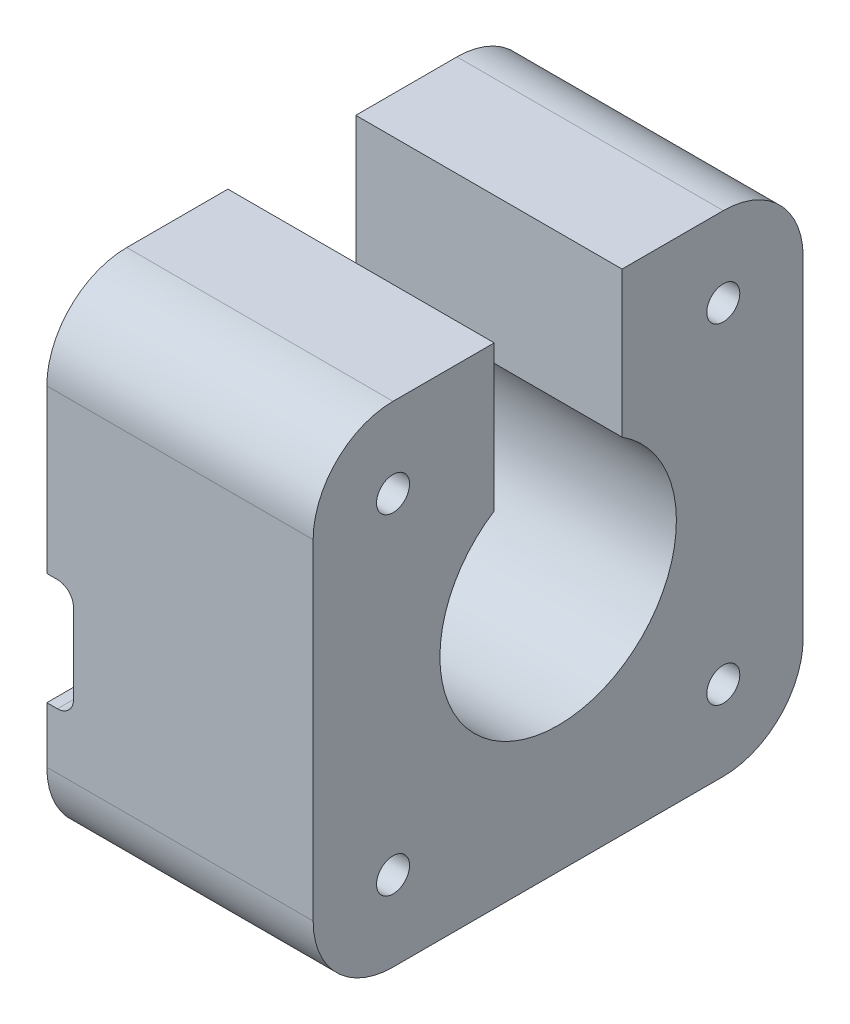
from build123d import *

# Parameters (mm, degrees)
CROQUIS1_R              = 11.1
CROQUIS1_R_2            = 1.55
SALIENTE_EXTRUIR1_DEPTH = 25
CORTAR_EXTRUIR1_DEPTH   = 42.024382994
CORTAR_EXTRUIR2_DEPTH   = 58.183913822


with BuildPart() as part:
    # Croquis1 → Saliente-Extruir1 (new body)
    with BuildSketch(Plane(origin=(0, 0, 0), x_dir=(0, 0, -1), z_dir=(1, 0, 0))):
        with BuildLine():
            Line((-15.5, 23), (15.5, 23))
            ThreePointArc((15.5, 23), (20.803300859, 20.803300859), (23, 15.5))
            Line((23, 15.5), (23, -15.5))
            ThreePointArc((23, -15.5), (20.803300859, -20.803300859), (15.5, -23))
            Line((15.5, -23), (-15.5, -23))
            ThreePointArc((-15.5, -23), (-20.803300859, -20.803300859), (-23, -15.5))
            Line((-23, -15.5), (-23, 15.5))
            ThreePointArc((-23, 15.5), (-20.803300859, 20.803300859), (-15.5, 23))
        make_face()
        Circle(CROQUIS1_R, mode=Mode.SUBTRACT)
        with Locations((-15.5, 15.5)):
            Circle(CROQUIS1_R_2, mode=Mode.SUBTRACT)
        with Locations((15.5, 15.5)):
            Circle(CROQUIS1_R_2, mode=Mode.SUBTRACT)
        with Locations((15.5, -15.5)):
            Circle(CROQUIS1_R_2, mode=Mode.SUBTRACT)
        with Locations((-15.5, -15.5)):
            Circle(CROQUIS1_R_2, mode=Mode.SUBTRACT)
    extrude(amount=SALIENTE_EXTRUIR1_DEPTH)

    # Croquis2 → Cortar-Extruir1 (cut, through all)
    with BuildSketch(Plane(origin=(25, 0, 0), x_dir=(0, 0, -1), z_dir=(1, 0, 0))):
        with BuildLine():
            Line((-6, 23), (-6, 9.33862945))
            ThreePointArc((-6, 9.33862945), (0, 11.1), (6, 9.33862945))
            Line((6, 9.33862945), (6, 23))
            Line((6, 23), (-6, 23))
        make_face()
    extrude(amount=-CORTAR_EXTRUIR1_DEPTH, mode=Mode.SUBTRACT)

    # Croquis3 → Cortar-Extruir2 (cut, through all)
    with BuildSketch(Plane(origin=(0, 0, -23), x_dir=(-1, 0, 0), z_dir=(0, 0, -1))):
        with BuildLine():
            Line((0, 0.25), (-1, 0.25))
            ThreePointArc((-1, 0.25), (-2.060660172, -0.189339828), (-2.5, -1.25))
            Line((-2.5, -1.25), (-2.5, -8.75))
            ThreePointArc((-2.5, -8.75), (-2.060660172, -9.810660172), (-1, -10.25))
            Line((-1, -10.25), (0, -10.25))
            Line((0, -10.25), (0, 0.25))
        make_face()
    extrude(amount=-CORTAR_EXTRUIR2_DEPTH, mode=Mode.SUBTRACT)


solid = part.part
